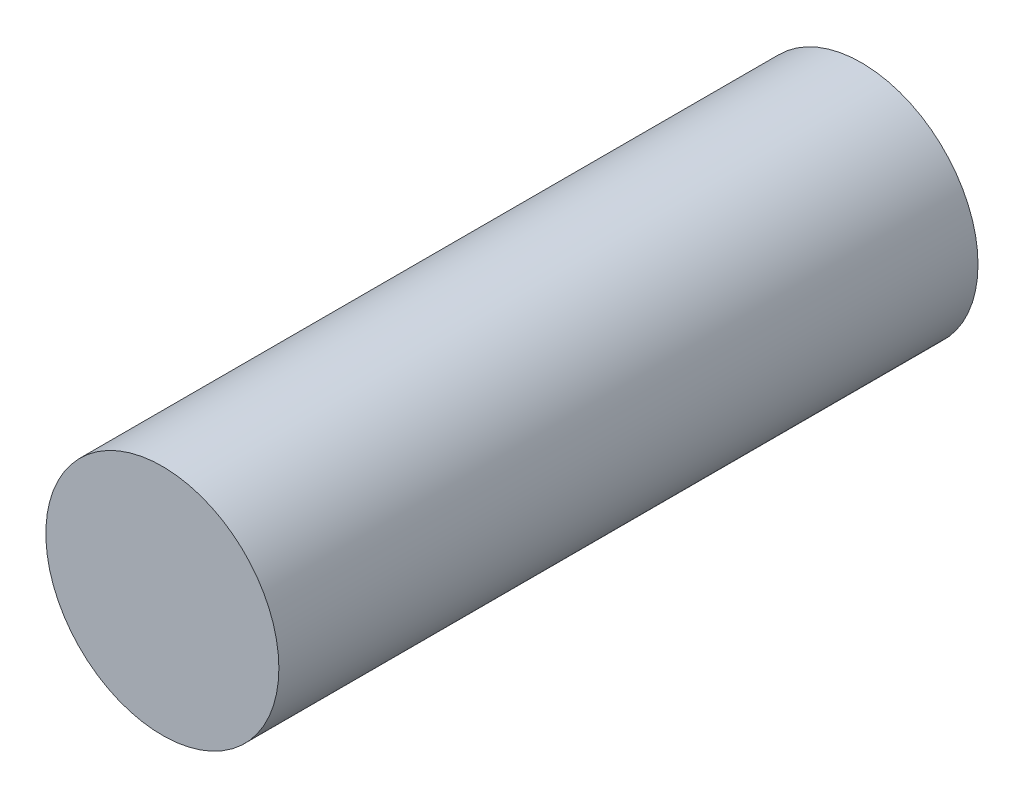
from build123d import *

# Parameters (mm, degrees)
ESQUISSE1_R        = 3
BOSS_EXTRU_1_DEPTH = 18


with BuildPart() as part:
    # Esquisse1 → Boss.-Extru.1 (new body)
    with BuildSketch(Plane.XY):
        Circle(ESQUISSE1_R)
    extrude(amount=BOSS_EXTRU_1_DEPTH)


solid = part.part
